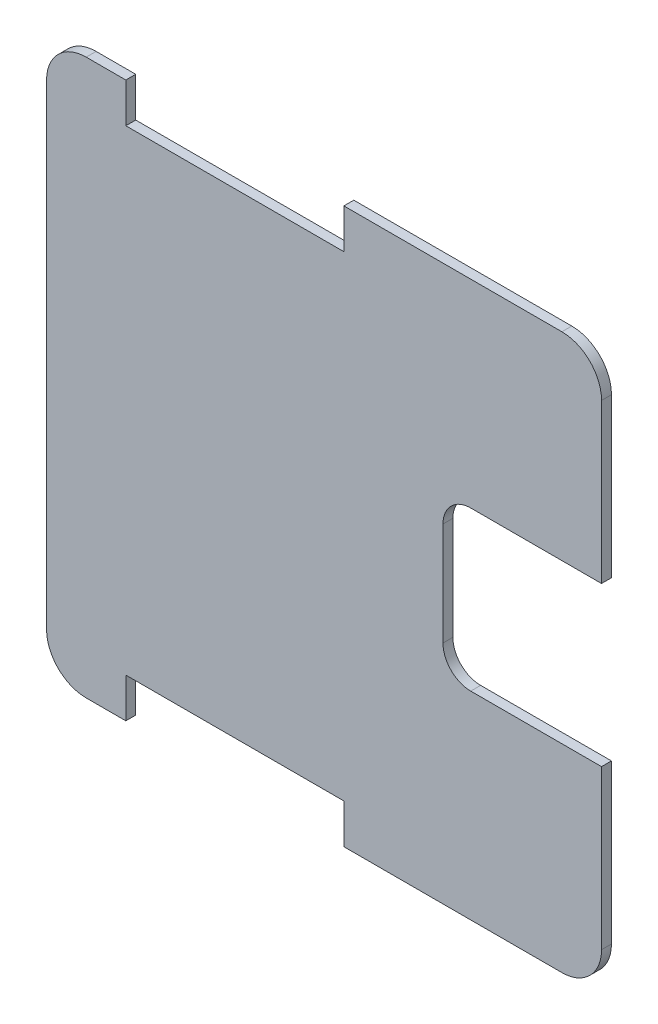
from build123d import *

# Parameters (mm, degrees)
BOSS_EXTRUDE1_DEPTH = 6.35
SKETCH2_W           = 139.7
SKETCH2_H           = 25.4
CUT_EXTRUDE1_DEPTH  = 503.934431611
CUT_EXTRUDE2_DEPTH  = 503.934431611


with BuildPart() as part:
    # Sketch1 → Boss-Extrude1 (new body)
    with BuildSketch(Plane.XY):
        with BuildLine():
            Line((25.4, 0), (330.2, 0))
            ThreePointArc((330.2, 0), (348.160512242, 7.439487758), (355.6, 25.4))
            Line((355.6, 25.4), (355.6, 330.2))
            ThreePointArc((355.6, 330.2), (348.160512242, 348.160512242), (330.2, 355.6))
            Line((330.2, 355.6), (25.4, 355.6))
            ThreePointArc((25.4, 355.6), (7.439487758, 348.160512242), (0, 330.2))
            Line((0, 330.2), (0, 25.4))
            ThreePointArc((0, 25.4), (7.439487758, 7.439487758), (25.4, 0))
        make_face()
    extrude(amount=BOSS_EXTRUDE1_DEPTH)

    # Sketch2 → Cut-Extrude1 (cut, through all)
    with BuildSketch(Plane(origin=(0, 0, 0), x_dir=(-1, 0, 0), z_dir=(0, 0, -1))):
        with Locations((-120.65, 342.9)):
            Rectangle(SKETCH2_W, SKETCH2_H)
        with Locations((-120.65, 12.7)):
            Rectangle(SKETCH2_W, SKETCH2_H)
    extrude(amount=-CUT_EXTRUDE1_DEPTH, mode=Mode.SUBTRACT)

    # Sketch3 → Cut-Extrude2 (cut, through all)
    with BuildSketch(Plane(origin=(0, 0, 0), x_dir=(-1, 0, 0), z_dir=(0, 0, -1))):
        with BuildLine():
            Line((-355.6, 127), (-271.78, 127))
            ThreePointArc((-271.78, 127), (-259.207641431, 132.207641431), (-254, 144.78))
            Line((-254, 144.78), (-254, 210.82))
            ThreePointArc((-254, 210.82), (-259.207641431, 223.392358569), (-271.78, 228.6))
            Line((-271.78, 228.6), (-355.6, 228.6))
            Line((-355.6, 228.6), (-355.6, 127))
        make_face()
    extrude(amount=-CUT_EXTRUDE2_DEPTH, mode=Mode.SUBTRACT)


solid = part.part
